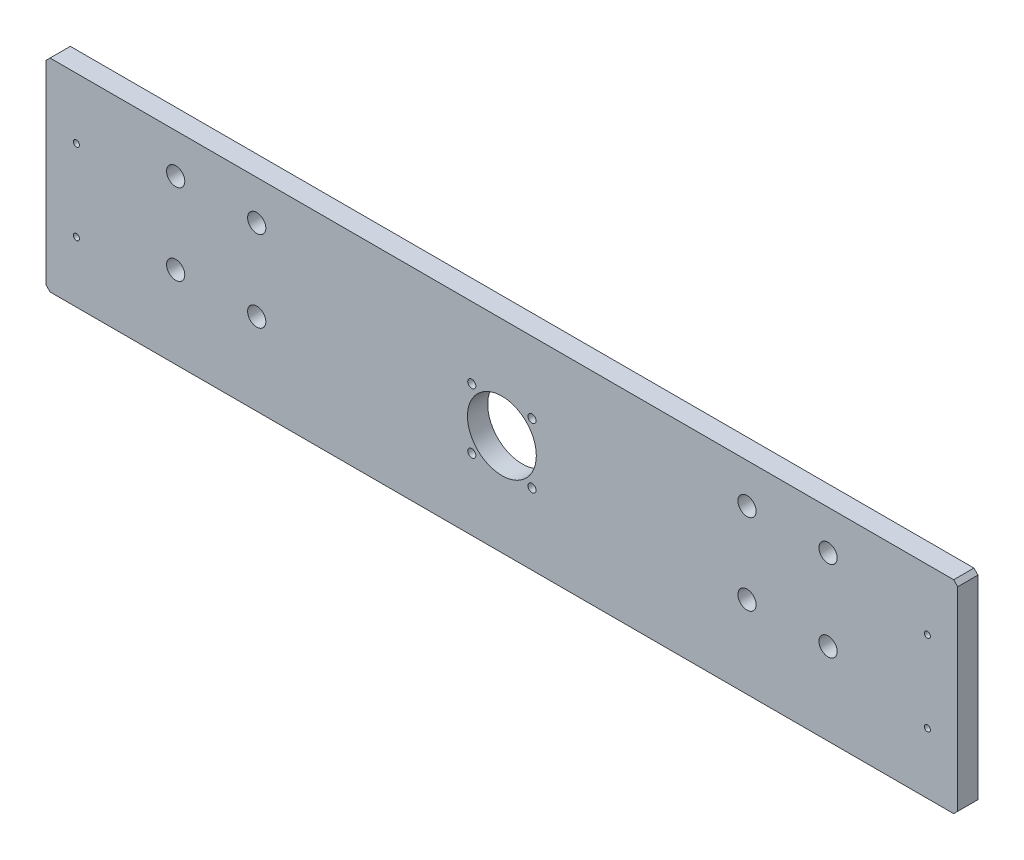
from build123d import *

# Parameters (mm, degrees)
SCHIZZO1_R                   = 17
SCHIZZO1_R_2                 = 2
SCHIZZO1_R_3                 = 4.5
SCHIZZO1_R_4                 = 1.5
ESTRUSIONE_ESTRUSIONE1_DEPTH = 10


with BuildPart() as part:
    # Schizzo1 → Estrusione-Estrusione1 (new body)
    with BuildSketch(Plane.XY):
        Polygon((2, 0), (448, 0), (450, 2), (450, 98), (448, 100), (2, 100), (0, 98), (0, 2), align=None)
        with Locations((225, 50)):
            Circle(SCHIZZO1_R, mode=Mode.SUBTRACT)
        with Locations(Location((239.849242405, 64.849242405, 0), (0, 0, 180))):
            Circle(SCHIZZO1_R_2, mode=Mode.SUBTRACT)
        with Locations(Location((104, 40.5, 0), (0, 0, 180))):
            Circle(SCHIZZO1_R_3, mode=Mode.SUBTRACT)
        with Locations((239.849242405, 35.150757595)):
            Circle(SCHIZZO1_R_2, mode=Mode.SUBTRACT)
        with Locations(Location((210.150757595, 35.150757595, 0), (0, 0, 180))):
            Circle(SCHIZZO1_R_2, mode=Mode.SUBTRACT)
        with Locations(Location((104, 80.5, 0), (0, 0, 180))):
            Circle(SCHIZZO1_R_3, mode=Mode.SUBTRACT)
        with Locations(Location((386, 40.5, 0), (0, 0, 180))):
            Circle(SCHIZZO1_R_3, mode=Mode.SUBTRACT)
        with Locations((64, 40.5)):
            Circle(SCHIZZO1_R_3, mode=Mode.SUBTRACT)
        with Locations((64, 80.5)):
            Circle(SCHIZZO1_R_3, mode=Mode.SUBTRACT)
        with Locations((346, 40.5)):
            Circle(SCHIZZO1_R_3, mode=Mode.SUBTRACT)
        with Locations((15, 30)):
            Circle(SCHIZZO1_R_4, mode=Mode.SUBTRACT)
        with Locations(Location((435, 30, 0), (0, 0, 180))):
            Circle(SCHIZZO1_R_4, mode=Mode.SUBTRACT)
        with Locations((210.150757595, 64.849242405)):
            Circle(SCHIZZO1_R_2, mode=Mode.SUBTRACT)
        with Locations((346, 80.5)):
            Circle(SCHIZZO1_R_3, mode=Mode.SUBTRACT)
        with Locations(Location((386, 80.5, 0), (0, 0, 180))):
            Circle(SCHIZZO1_R_3, mode=Mode.SUBTRACT)
        with Locations((435, 70)):
            Circle(SCHIZZO1_R_4, mode=Mode.SUBTRACT)
        with Locations(Location((15, 70, 0), (0, 0, 180))):
            Circle(SCHIZZO1_R_4, mode=Mode.SUBTRACT)
    extrude(amount=-ESTRUSIONE_ESTRUSIONE1_DEPTH)


solid = part.part
